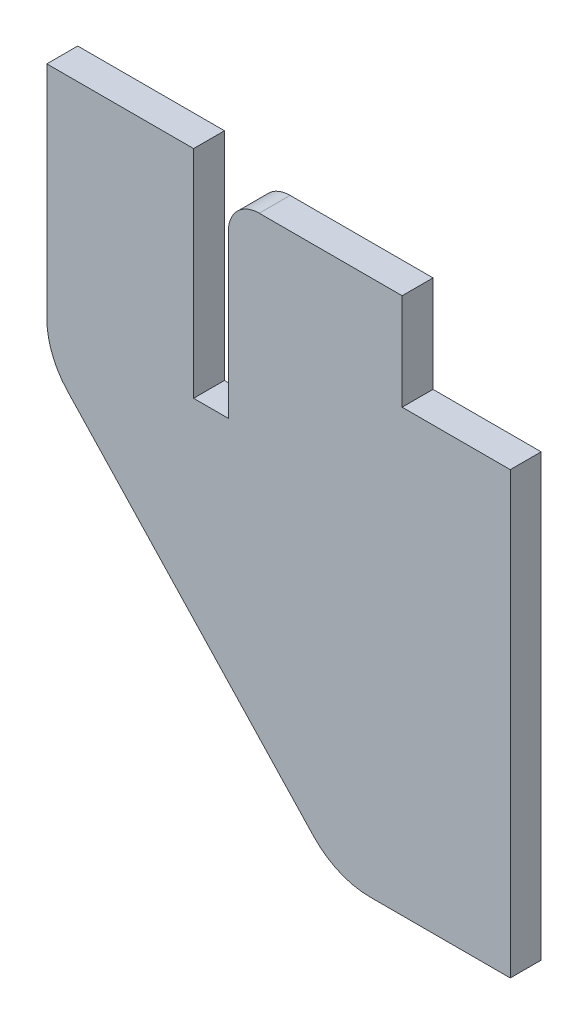
from build123d import *

# Parameters (mm, degrees)
EXTRUDE_1_DEPTH = 8
FILLET_1_R      = 20


with BuildPart() as part:
    # 草图1 → 凸台-拉伸1 (new body)
    with BuildSketch(Plane.XY):
        with BuildLine():
            Line((0, 0), (0, 114))
            Line((0, 114), (-28, 114))
            Line((-28, 114), (-28, 139))
            Line((-28, 139), (-65, 139))
            ThreePointArc((-65, 139), (-70.656854249, 136.656854249), (-73, 131))
            Line((-73, 131), (-73, 89))
            Line((-73, 89), (-82, 89))
            Line((-82, 89), (-82, 145))
            Line((-82, 145), (-120, 145))
            Line((-120, 145), (-120, 80))
            Line((-120, 80), (-45, 0))
            Line((-45, 0), (0, 0))
        make_face()
    extrude(amount=EXTRUDE_1_DEPTH)

    # 圆角1
    fillet_1_edges = [part.edges().sort_by_distance(p)[0] for p in [
        (-45, 0, 4),
        (-120, 80, 4),
    ]]
    fillet(fillet_1_edges, radius=FILLET_1_R)


solid = part.part
